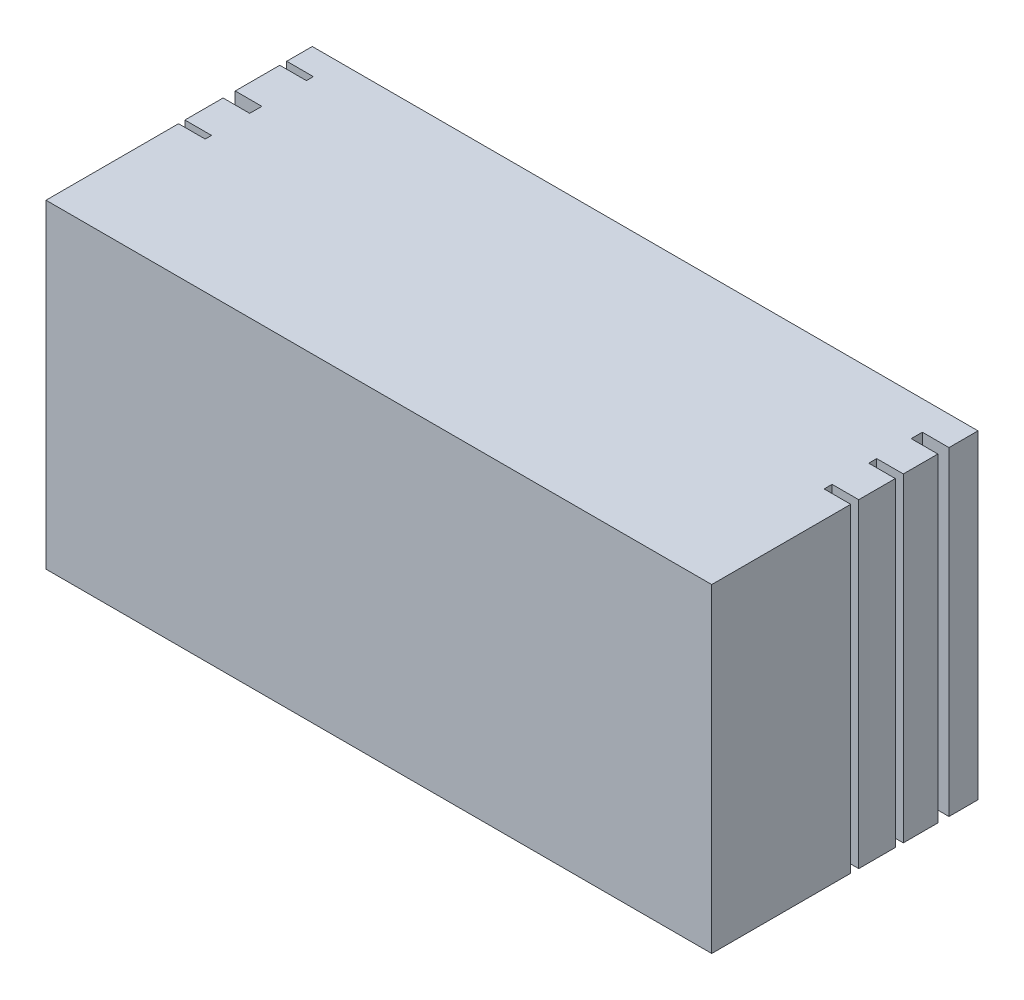
from build123d import *

# Parameters (mm, degrees)
SKETCH_1_W          = 250
SKETCH_1_H          = 120
EXTRUDE_1_DEPTH     = 100
SKETCH_2_W          = 3
SKETCH_2_H          = 141.063947636
SKETCH_2_W_2        = 4.187427017
CUT_EXTRUDE_1_DEPTH = 10
SKETCH_3_W          = 2.606673318
SKETCH_3_H          = 138.805354188
SKETCH_3_W_2        = 4.561678307
SKETCH_3_W_3        = 2.389450542
CUT_EXTRUDE_2_DEPTH = 10


with BuildPart() as part:
    # 스케치1 → 보스-돌출1 (new body)
    with BuildSketch(Plane.XY):
        with Locations((45, 0)):
            Rectangle(SKETCH_1_W, SKETCH_1_H)
    extrude(amount=EXTRUDE_1_DEPTH)

    # 스케치2 → 컷-돌출1 (cut)
    with BuildSketch(Plane(origin=(170, 0, 0), x_dir=(0, 0, -1), z_dir=(1, 0, 0))):
        with Locations((-46.296564822, 2.74799898)):
            Rectangle(SKETCH_2_W, SKETCH_2_H)
        with Locations((-29.546856754, 2.74799898)):
            Rectangle(SKETCH_2_W, SKETCH_2_H)
        with Locations((-12.988577744, 2.74799898)):
            Rectangle(SKETCH_2_W_2, SKETCH_2_H)
    extrude(amount=-CUT_EXTRUDE_1_DEPTH, mode=Mode.SUBTRACT)

    # 스케치3 → 컷-돌출2 (cut)
    with BuildSketch(Plane.ZY.offset(80)):
        with Locations((10.910436229, 0.546851797)):
            Rectangle(SKETCH_3_W, SKETCH_3_H)
        with Locations((31.220765833, 0.546851797)):
            Rectangle(SKETCH_3_W_2, SKETCH_3_H)
        with Locations((49.033033506, 0.546851797)):
            Rectangle(SKETCH_3_W_3, SKETCH_3_H)
    extrude(amount=-CUT_EXTRUDE_2_DEPTH, mode=Mode.SUBTRACT)


solid = part.part
